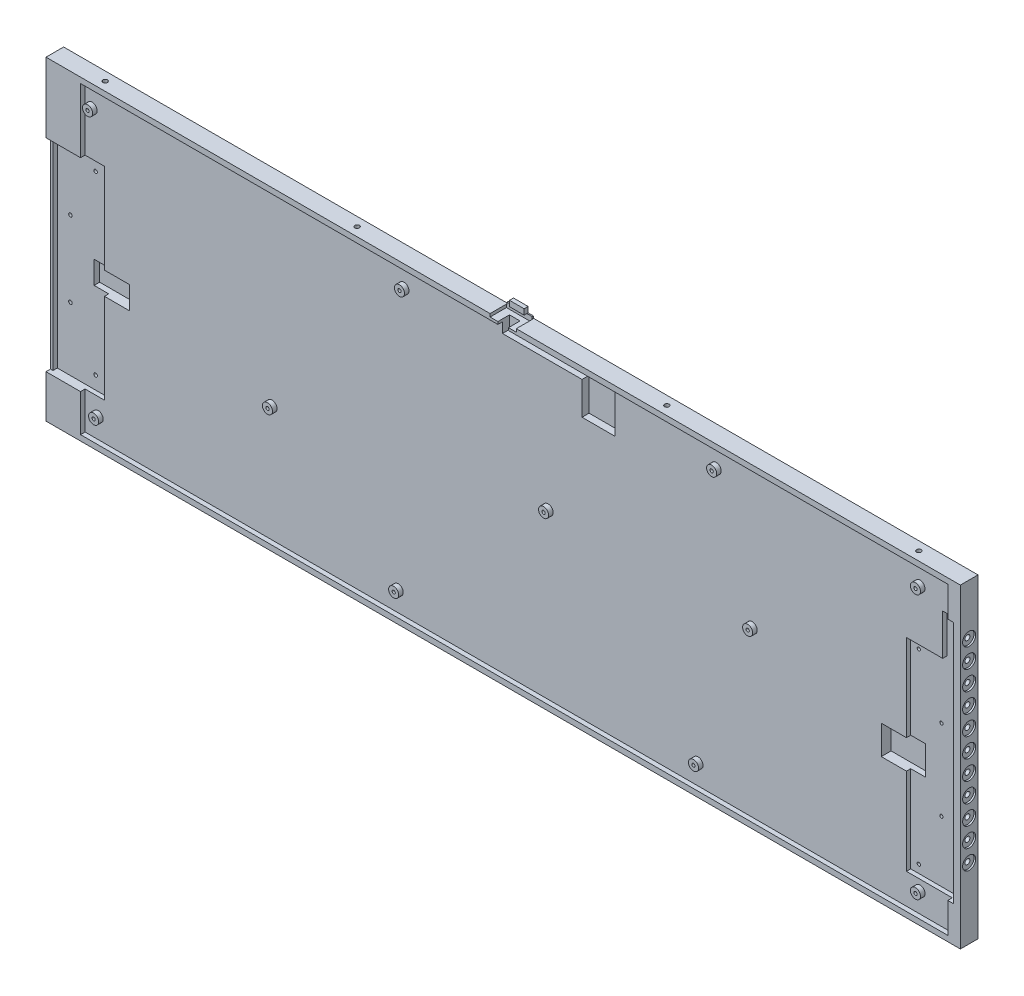
from build123d import *

# Parameters (mm, degrees)
SKETCH_1_W                      = 348.235
SKETCH_1_H                      = 124.714
EXTRUDE_1_DEPTH                 = 7
SKETCH_2_W                      = 344.235
SKETCH_2_H                      = 120.714
CUT_EXTRUDE_1_DEPTH             = 1.8
SKETCH_3_R                      = 2
SKETCH_3_R_2                    = 0.65
EXTRUDE_2_DEPTH                 = 1.8
CUT_EXTRUDE_2_DEPTH             = 370.930043415
CUT_EXTRUDE_2_DEPTH_BACK        = 1.7
SKETCH_4_W                      = 9.7
SKETCH_4_H                      = 80.4
SKETCH_6_W                      = 15.8
SKETCH_6_H                      = 9
CUT_EXTRUDE_3_DEPTH             = 3.9
SKETCH_7_W                      = 3.5
SKETCH_7_H                      = 80.4
EXTRUDE_3_DEPTH                 = 11.7
SKETCH_8_R                      = 0.7
CUT_EXTRUDE_4_DEPTH             = 3
SKETCH_9_W                      = 1
SKETCH_9_H                      = 80.4
EXTRUDE_4_DEPTH                 = 1.7
CUT_EXTRUDE_5_DEPTH             = 370.930043415
CUT_EXTRUDE_5_DEPTH_BACK        = 1.7
SKETCH_10_W                     = 20.2
SKETCH_10_H                     = 80.4
CUT_EXTRUDE_6_DEPTH             = 370.910052609
CUT_EXTRUDE_6_DEPTH_BACK        = 2.2
SKETCH_11_W                     = 15.8
SKETCH_11_H                     = 11.5
SKETCH_12_R                     = 0.65
CUT_EXTRUDE_7_DEPTH             = 3
SKETCH_13_W                     = 3
SKETCH_13_H                     = 124.714
EXTRUDE_5_DEPTH                 = 7
CUT_EXTRUDE_8_REACH             = 374.755
SKETCH_14_W                     = 6
SKETCH_14_H                     = 96.714
CUT_EXTRUDE_8_DIRECTION_2_DEPTH = 3
SKETCH_15_R                     = 2.6
CUT_EXTRUDE_9_DEPTH             = 0.7
SKETCH_15_3_R                   = 1
CUT_EXTRUDE_10_DEPTH            = 2.8
SKETCH_16_W                     = 362.935
SKETCH_16_H                     = 7
EXTRUDE_6_DEPTH                 = 0.2
SKETCH_17_W                     = 362.935
SKETCH_17_H                     = 7
EXTRUDE_7_DEPTH                 = 0.2
SKETCH_18_W                     = 10.4
SKETCH_18_H                     = 8.2
CUT_EXTRUDE_11_DEPTH            = 1.2
SKETCH_19_W                     = 4.2
SKETCH_19_H                     = 4.6
CUT_EXTRUDE_12_DEPTH            = 2.2
SKETCH_20_W                     = 10
SKETCH_20_H                     = 0.5
EXTRUDE_8_DEPTH                 = 0.8
SKETCH_21_W                     = 5.8
SKETCH_21_H                     = 1.6
EXTRUDE_9_DEPTH                 = 2.2
SKETCH_22_W                     = 13
SKETCH_22_H                     = 13
CUT_EXTRUDE_13_DEPTH            = 2.8
SKETCH_23_R                     = 5.6
SKETCH_23_R_2                   = 4.1
CUT_EXTRUDE_14_DEPTH            = 1
SKETCH_24_R                     = 0.9
CUT_EXTRUDE_15_DEPTH            = 3
CUT_EXTRUDE_START               = -122.114
SKETCH_24_2_R                   = 0.9
CUT_EXTRUDE_16_DEPTH            = 3


with BuildPart() as part:
    # 草图1 → 凸台-拉伸1 (new body)
    with BuildSketch(Plane.XY):
        with Locations((174.1175, -62.357)):
            Rectangle(SKETCH_1_W, SKETCH_1_H)
    extrude(amount=EXTRUDE_1_DEPTH)

    # 草图2 → 切除-拉伸1 (cut)
    with BuildSketch(Plane.XY.offset(7)):
        with Locations((174.1175, -62.357)):
            Rectangle(SKETCH_2_W, SKETCH_2_H)
    extrude(amount=-CUT_EXTRUDE_1_DEPTH, mode=Mode.SUBTRACT)

    # 草图3 → 凸台-拉伸2 (add)
    # profile 1 of 11: a face of its own
    with BuildSketch(Plane.XY.offset(5.2)):
        with Locations((4.8, -9.9)):
            Circle(SKETCH_3_R)
        with Locations((4.8, -9.9)):
            Circle(SKETCH_3_R_2, mode=Mode.SUBTRACT)
    # profile 2 of 11: a face of its own
    with BuildSketch(Plane.XY.offset(5.2)):
        with Locations((7.2, -114.7)):
            Circle(SKETCH_3_R)
        with Locations((7.2, -114.7)):
            Circle(SKETCH_3_R_2, mode=Mode.SUBTRACT)
    # profile 3 of 11: a face of its own
    with BuildSketch(Plane.XY.offset(5.2)):
        with Locations((76.2, -76.6)):
            Circle(SKETCH_3_R)
        with Locations((76.2, -76.6)):
            Circle(SKETCH_3_R_2, mode=Mode.SUBTRACT)
    # profile 4 of 11: a face of its own
    with BuildSketch(Plane.XY.offset(5.2)):
        with Locations((128.6, -9.9)):
            Circle(SKETCH_3_R)
        with Locations((128.6, -9.9)):
            Circle(SKETCH_3_R_2, mode=Mode.SUBTRACT)
    # profile 5 of 11: a face of its own
    with BuildSketch(Plane.XY.offset(5.2)):
        with Locations((126.3, -114.7)):
            Circle(SKETCH_3_R)
        with Locations((126.3, -114.7)):
            Circle(SKETCH_3_R_2, mode=Mode.SUBTRACT)
    # profile 6 of 11: a face of its own
    with BuildSketch(Plane.XY.offset(5.2)):
        with Locations((185.8, -57.5)):
            Circle(SKETCH_3_R)
        with Locations((185.8, -57.5)):
            Circle(SKETCH_3_R_2, mode=Mode.SUBTRACT)
    # profile 7 of 11: a face of its own
    with BuildSketch(Plane.XY.offset(5.2)):
        with Locations((252.5, -9.9)):
            Circle(SKETCH_3_R)
        with Locations((252.5, -9.9)):
            Circle(SKETCH_3_R_2, mode=Mode.SUBTRACT)
    # profile 8 of 11: a face of its own
    with BuildSketch(Plane.XY.offset(5.2)):
        with Locations((245.3, -114.7)):
            Circle(SKETCH_3_R)
        with Locations((245.3, -114.7)):
            Circle(SKETCH_3_R_2, mode=Mode.SUBTRACT)
    # profile 9 of 11: a face of its own
    with BuildSketch(Plane.XY.offset(5.2)):
        with Locations((333.4, -9.9)):
            Circle(SKETCH_3_R)
        with Locations((333.4, -9.9)):
            Circle(SKETCH_3_R_2, mode=Mode.SUBTRACT)
    # profile 10 of 11: a face of its own
    with BuildSketch(Plane.XY.offset(5.2)):
        with Locations((333.4, -114.7)):
            Circle(SKETCH_3_R)
        with Locations((333.4, -114.7)):
            Circle(SKETCH_3_R_2, mode=Mode.SUBTRACT)
    # profile 11 of 11: a face of its own
    with BuildSketch(Plane.XY.offset(5.2)):
        with Locations((266.8, -57.5)):
            Circle(SKETCH_3_R)
        with Locations((266.8, -57.5)):
            Circle(SKETCH_3_R_2, mode=Mode.SUBTRACT)
    extrude(amount=EXTRUDE_2_DEPTH)

    # 草图4 → 切除-拉伸2 (cut, two sides: drawn at the far end of the back side and taken through both)
    with BuildSketch(Plane.XY.offset(5.2).offset(-CUT_EXTRUDE_2_DEPTH_BACK)):
        with Locations((4.85, -67.714)):
            Rectangle(SKETCH_4_W, SKETCH_4_H)
    extrude(amount=CUT_EXTRUDE_2_DEPTH + CUT_EXTRUDE_2_DEPTH_BACK, mode=Mode.SUBTRACT)

    # 草图6 → 切除-拉伸3 (cut)
    with BuildSketch(Plane.XY.offset(5.2)):
        with Locations((11.8, -67.714)):
            Rectangle(SKETCH_6_W, SKETCH_6_H)
    extrude(amount=-CUT_EXTRUDE_3_DEPTH, mode=Mode.SUBTRACT)

    # 草图7 → 凸台-拉伸3 (add)
    with BuildSketch(Plane.ZY):
        Polygon((7, 0), (0, 0), (0, -27.514), (3.5, -27.514), (7, -27.514), align=None)
        with Locations((1.75, -67.714)):
            Rectangle(SKETCH_7_W, SKETCH_7_H)
        Polygon((3.5, -107.914), (0, -107.914), (0, -124.714), (7, -124.714), (7, -107.914), align=None)
    extrude(amount=EXTRUDE_3_DEPTH)

    # 草图8 → 切除-拉伸4 (cut)
    with BuildSketch(Plane.XY.offset(3.5)):
        with Locations((-5.5, -82.714)):
            Circle(SKETCH_8_R)
        with Locations((4.5, -102.714)):
            Circle(SKETCH_8_R)
        with Locations((-5.5, -52.714)):
            Circle(SKETCH_8_R)
        with Locations((4.5, -32.714)):
            Circle(SKETCH_8_R)
    extrude(amount=-CUT_EXTRUDE_4_DEPTH, mode=Mode.SUBTRACT)

    # 草图9 → 凸台-拉伸4 (add)
    with BuildSketch(Plane.XY.offset(3.5)):
        with Locations((-11.2, -67.714)):
            Rectangle(SKETCH_9_W, SKETCH_9_H)
    extrude(amount=EXTRUDE_4_DEPTH)

    # 草图10 → 切除-拉伸5 (cut, two sides: drawn at the far end of the back side and taken through both)
    with BuildSketch(Plane.XY.offset(5.2).offset(-CUT_EXTRUDE_5_DEPTH_BACK)):
        with Locations((338.135, -70.514)):
            Rectangle(SKETCH_10_W, SKETCH_10_H)
    extrude(amount=CUT_EXTRUDE_5_DEPTH + CUT_EXTRUDE_5_DEPTH_BACK, mode=Mode.SUBTRACT)

    # 草图11 → 切除-拉伸6 (cut, two sides: drawn at the far end of the back side and taken through both)
    with BuildSketch(Plane.XY.offset(3.5).offset(-CUT_EXTRUDE_6_DEPTH_BACK)):
        with Locations((325.935, -70.514)):
            Rectangle(SKETCH_11_W, SKETCH_11_H)
    extrude(amount=CUT_EXTRUDE_6_DEPTH + CUT_EXTRUDE_6_DEPTH_BACK, mode=Mode.SUBTRACT)

    # 草图12 → 切除-拉伸7 (cut)
    with BuildSketch(Plane.XY.offset(3.5)):
        with Locations((331.235, -107.514)):
            Circle(SKETCH_12_R)
        with Locations((340.235, -86.514)):
            Circle(SKETCH_12_R)
        with Locations((340.235, -54.514)):
            Circle(SKETCH_12_R)
        with Locations((331.235, -33.514)):
            Circle(SKETCH_12_R)
    extrude(amount=-CUT_EXTRUDE_7_DEPTH, mode=Mode.SUBTRACT)

    # 草图13 → 凸台-拉伸5 (add)
    with BuildSketch(Plane(origin=(0, 0, 0), x_dir=(-1, 0, 0), z_dir=(0, 0, -1))):
        with Locations((-349.735, -62.357)):
            Rectangle(SKETCH_13_W, SKETCH_13_H)
    extrude(amount=-EXTRUDE_5_DEPTH)

    # 切除-拉伸8: up to this face of the body (flat: up to its plane)
    cut_extrude_8_end = Plane(part.part.faces().sort_by_distance((338.452628763, -70.514, 3.5))[0])
    # 草图14 → 切除-拉伸8 (cut, up to the picked face)
    with BuildSketch(Plane.XY.offset(5.2), mode=Mode.PRIVATE) as cut_extrude_8_sk1:
        with Locations((345.435, -62.357)):
            Rectangle(SKETCH_14_W, SKETCH_14_H)
    cut_extrude_8_tool1 = split(extrude(cut_extrude_8_sk1.sketch, amount=-CUT_EXTRUDE_8_REACH, mode=Mode.PRIVATE), bisect_by=cut_extrude_8_end, keep=Keep.BOTH, mode=Mode.PRIVATE)
    add(cut_extrude_8_tool1.solids().sort_by(Axis((345.435, -62.357, 5.2), (0, 0, -1)))[0], mode=Mode.SUBTRACT)

    # 草图14 → 切除-拉伸8 direction 2 (cut)
    with BuildSketch(Plane.XY.offset(5.2)):
        with Locations((345.435, -62.357)):
            Rectangle(SKETCH_14_W, SKETCH_14_H)
    extrude(amount=CUT_EXTRUDE_8_DIRECTION_2_DEPTH, mode=Mode.SUBTRACT)

    # 草图15 → 切除-拉伸9 (cut)
    with BuildSketch(Plane(origin=(351.235, 0, 0), x_dir=(0, 0, -1), z_dir=(1, 0, 0))):
        with Locations((-3.5, -20)):
            Circle(SKETCH_15_R)
        with Locations((-3.5, -27.701272727)):
            Circle(SKETCH_15_R)
        with Locations((-3.5, -35.402545455)):
            Circle(SKETCH_15_R)
        with Locations((-3.5, -43.103818182)):
            Circle(SKETCH_15_R)
        with Locations((-3.5, -50.805090909)):
            Circle(SKETCH_15_R)
        with Locations((-3.5, -58.506363636)):
            Circle(SKETCH_15_R)
        with Locations((-3.5, -66.207636364)):
            Circle(SKETCH_15_R)
        with Locations((-3.5, -73.908909091)):
            Circle(SKETCH_15_R)
        with Locations((-3.5, -81.610181818)):
            Circle(SKETCH_15_R)
        with Locations((-3.5, -89.311454545)):
            Circle(SKETCH_15_R)
        with Locations((-3.5, -97.012727273)):
            Circle(SKETCH_15_R)
    extrude(amount=-CUT_EXTRUDE_9_DEPTH, mode=Mode.SUBTRACT)

    # 草图15<3> → 切除-拉伸10 (cut)
    with BuildSketch(Plane(origin=(351.235, 0, 0), x_dir=(0, 0, -1), z_dir=(1, 0, 0))):
        with Locations((-3.5, -20)):
            Circle(SKETCH_15_3_R)
        with Locations((-3.5, -27.701272727)):
            Circle(SKETCH_15_3_R)
        with Locations((-3.5, -35.402545455)):
            Circle(SKETCH_15_3_R)
        with Locations((-3.5, -43.103818182)):
            Circle(SKETCH_15_3_R)
        with Locations((-3.5, -50.805090909)):
            Circle(SKETCH_15_3_R)
        with Locations((-3.5, -58.506363636)):
            Circle(SKETCH_15_3_R)
        with Locations((-3.5, -66.207636364)):
            Circle(SKETCH_15_3_R)
        with Locations((-3.5, -73.908909091)):
            Circle(SKETCH_15_3_R)
        with Locations((-3.5, -81.610181818)):
            Circle(SKETCH_15_3_R)
        with Locations((-3.5, -89.311454545)):
            Circle(SKETCH_15_3_R)
        with Locations((-3.5, -97.012727273)):
            Circle(SKETCH_15_3_R)
    extrude(amount=-CUT_EXTRUDE_10_DEPTH, mode=Mode.SUBTRACT)

    # 草图16 → 凸台-拉伸6 (add)
    with BuildSketch(Plane(origin=(0, 0, 0), x_dir=(1, 0, 0), z_dir=(0, 1, 0))):
        with Locations((169.7675, -3.5)):
            Rectangle(SKETCH_16_W, SKETCH_16_H)
    extrude(amount=EXTRUDE_6_DEPTH)

    # 草图17 → 凸台-拉伸7 (add)
    with BuildSketch(Plane.XZ.offset(124.714)):
        with Locations((169.7675, 3.5)):
            Rectangle(SKETCH_17_W, SKETCH_17_H)
    extrude(amount=EXTRUDE_7_DEPTH)

    # 草图18 → 切除-拉伸11 (cut)
    with BuildSketch(Plane(origin=(0, 0.2, 0), x_dir=(1, 0, 0), z_dir=(0, 1, 0))):
        with Locations((169.7675, -4.6)):
            Rectangle(SKETCH_18_W, SKETCH_18_H)
    extrude(amount=-CUT_EXTRUDE_11_DEPTH, mode=Mode.SUBTRACT)

    # 草图19 → 切除-拉伸12 (cut)
    with BuildSketch(Plane(origin=(0, 0.2, 0), x_dir=(1, 0, 0), z_dir=(0, 1, 0))):
        with Locations((169.7675, -4.7)):
            Rectangle(SKETCH_19_W, SKETCH_19_H)
    extrude(amount=-CUT_EXTRUDE_12_DEPTH, mode=Mode.SUBTRACT)

    # 草图20 → 凸台-拉伸8 (add)
    with BuildSketch(Plane(origin=(0, 0.2, 0), x_dir=(1, 0, 0), z_dir=(0, 1, 0))):
        with Locations((169.7675, -0.25)):
            Rectangle(SKETCH_20_W, SKETCH_20_H)
    extrude(amount=EXTRUDE_8_DEPTH)

    # 草图21 → 凸台-拉伸9 (add)
    with BuildSketch(Plane(origin=(0, 1, 0), x_dir=(1, 0, 0), z_dir=(0, 1, 0))):
        with Locations((169.7675, -0.8)):
            Rectangle(SKETCH_21_W, SKETCH_21_H)
    extrude(amount=EXTRUDE_9_DEPTH)

    # 草图22 → 切除-拉伸13 (cut)
    with BuildSketch(Plane.XY.offset(5.2)):
        Polygon((171.8675, -2), (167.6675, -2), (167.6675, -6), (199.2675, -6), (212.2675, -6), (212.2675, -2), align=None)
        with Locations((205.7675, -12.5)):
            Rectangle(SKETCH_22_W, SKETCH_22_H)
    extrude(amount=-CUT_EXTRUDE_13_DEPTH, mode=Mode.SUBTRACT)

    # 草图23 → 切除-拉伸14 (cut)
    with BuildSketch(Plane(origin=(0, 0, 0), x_dir=(-1, 0, 0), z_dir=(0, 0, -1))):
        with Locations((-331.235, -19.8)):
            Circle(SKETCH_23_R)
        with Locations((-231.235, -19.8)):
            Circle(SKETCH_23_R)
        with Locations((-108.3, -19.8)):
            Circle(SKETCH_23_R)
        with Locations((-8.3, -19.8)):
            Circle(SKETCH_23_R)
        with Locations((-331.235, -104.914)):
            Circle(SKETCH_23_R_2)
        with Locations((-231.235, -104.914)):
            Circle(SKETCH_23_R_2)
        with Locations((-108.3, -104.914)):
            Circle(SKETCH_23_R_2)
        with Locations((-8.3, -104.914)):
            Circle(SKETCH_23_R_2)
    extrude(amount=-CUT_EXTRUDE_14_DEPTH, mode=Mode.SUBTRACT)

    # 草图24 → 切除-拉伸15 (cut)
    with BuildSketch(Plane(origin=(0, 0.2, 0), x_dir=(1, 0, 0), z_dir=(0, 1, 0))):
        with Locations(Location((8.3, -3.5, 0), (0, 0, 270))):
            Circle(SKETCH_24_R)
        with Locations(Location((108.3, -3.5, 0), (0, 0, 270))):
            Circle(SKETCH_24_R)
        with Locations(Location((231.235, -3.5, 0), (0, 0, 270))):
            Circle(SKETCH_24_R)
        with Locations(Location((331.235, -3.5, 0), (0, 0, 270))):
            Circle(SKETCH_24_R)
    extrude(amount=-CUT_EXTRUDE_15_DEPTH, mode=Mode.SUBTRACT)

    # 草图24<2> → 切除-拉伸16 (cut)
    with BuildSketch(Plane(origin=(0, 0.2, 0), x_dir=(1, 0, 0), z_dir=(0, 1, 0)).offset(CUT_EXTRUDE_START)):
        with Locations(Location((8.3, -3.5, 0), (0, 0, 270))):
            Circle(SKETCH_24_2_R)
        with Locations(Location((108.3, -3.5, 0), (0, 0, 270))):
            Circle(SKETCH_24_2_R)
        with Locations(Location((231.235, -3.5, 0), (0, 0, 270))):
            Circle(SKETCH_24_2_R)
        with Locations(Location((331.235, -3.5, 0), (0, 0, 270))):
            Circle(SKETCH_24_2_R)
    extrude(amount=-CUT_EXTRUDE_16_DEPTH, mode=Mode.SUBTRACT)


solid = part.part
